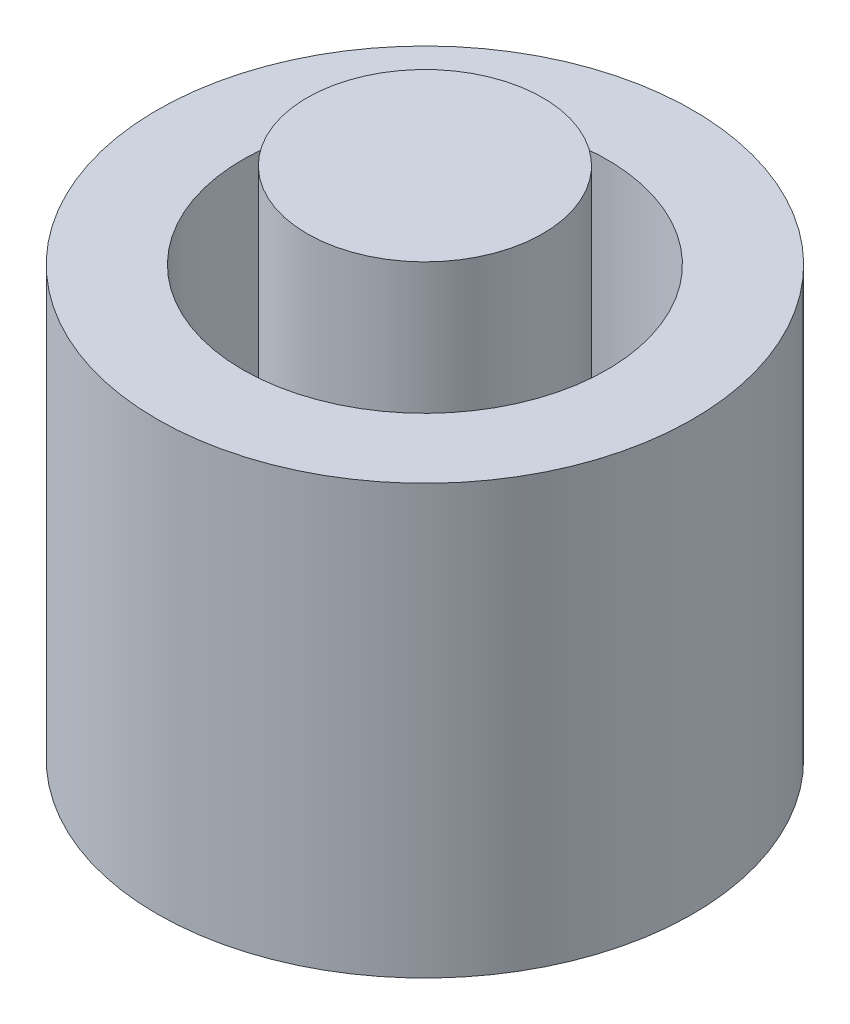
from build123d import *

# Parameters (mm, degrees)
SKETCH_1_R      = 6.25
EXTRUDE_2_DEPTH = 10
SHELL_1_T       = -2
SKETCH_2_R      = 2.75
EXTRUDE_3_DEPTH = 10


with BuildPart() as part:
    # 草图1 → 凸台-拉伸2 (new body)
    with BuildSketch(Plane(origin=(0, 0, 0), x_dir=(1, 0, 0), z_dir=(0, 1, 0))):
        with Locations(Location((0, 0, 0), (0, 0, 270))):
            Circle(SKETCH_1_R)
    extrude(amount=EXTRUDE_2_DEPTH)

    # 抽壳1
    shell_1_openings = [part.faces().sort_by_distance(p)[0] for p in [
        (0, 10, 0),
    ]]
    offset(amount=SHELL_1_T, openings=shell_1_openings, kind=Kind.INTERSECTION)

    # 草图2 → 凸台-拉伸3 (add)
    with BuildSketch(Plane(origin=(0, 2, 0), x_dir=(1, 0, 0), z_dir=(0, 1, 0))):
        with Locations(Location((0, 0, 0), (0, 0, 270))):
            Circle(SKETCH_2_R)
    extrude(amount=EXTRUDE_3_DEPTH)


solid = part.part
